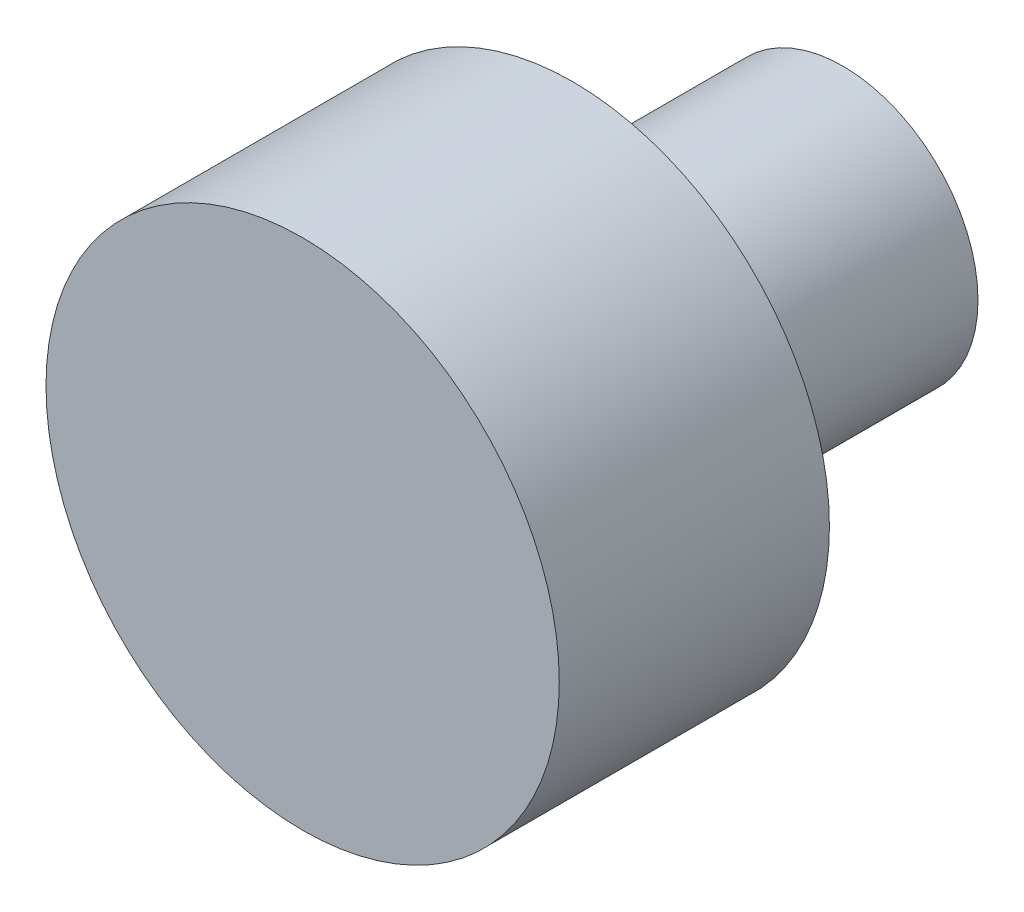
from build123d import *

# Parameters (mm, degrees)
THREAD_ENVELOPE_START = -2
SKETCH1_R             = 1
THREAD_ENVELOPE_DEPTH = 2
SKETCH2_R             = 1.9
HEAD_ENVELOPE_DEPTH   = 2


with BuildPart() as part:
    # Sketch1 → Thread_Envelope (new body)
    with BuildSketch(Plane.XY.offset(THREAD_ENVELOPE_START)):
        Circle(SKETCH1_R)
    extrude(amount=THREAD_ENVELOPE_DEPTH)

    # Sketch2 → Head_Envelope (add)
    with BuildSketch(Plane.XY):
        Circle(SKETCH2_R)
    extrude(amount=HEAD_ENVELOPE_DEPTH)


solid = part.part
